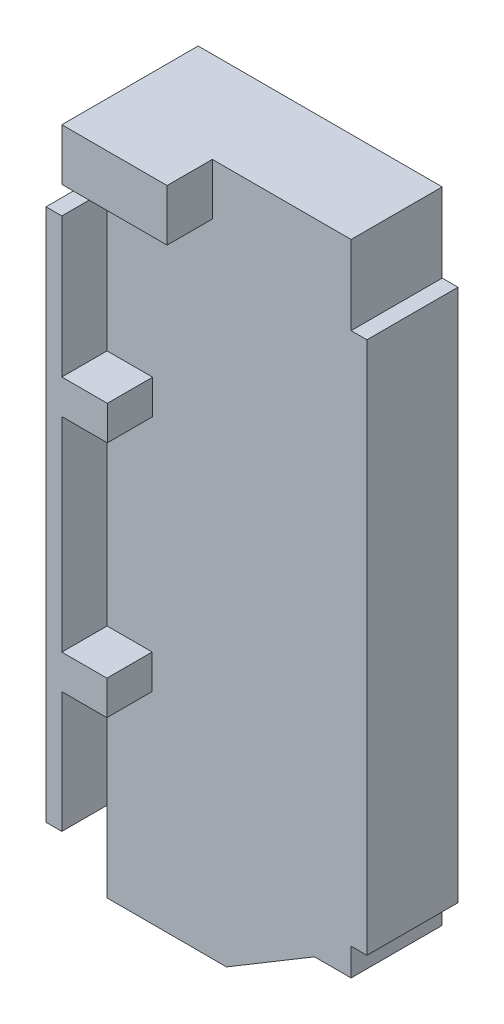
from build123d import *

# Parameters (mm, degrees)
BOSS_EXTRUDE1_DEPTH = 43.942
SKETCH2_6_W         = 50.8
SKETCH2_6_H         = 24.9047
BOSS_EXTRUDE3_DEPTH = 21.844


with BuildPart() as part:
    # Sketch2 → Boss-Extrude1 (new body)
    with BuildSketch(Plane.XY):
        Polygon((-25.4, 384.175), (-33.02, 384.175), (-33.02, 127), (-25.4, 127), (-25.4, 88.2904), (32.21228, 88.2904), (74.6506, 113.7158), (92.329, 113.7158), (92.329, 127), (99.949, 127), (99.949, 384.175), (92.329, 384.175), (92.329, 422.275), (-25.4, 422.275), align=None)
    extrude(amount=-BOSS_EXTRUDE1_DEPTH)

    # Sketch2<6> → Boss-Extrude3 (add)
    with BuildSketch(Plane.XY):
        Polygon((-25.4, 316.865), (-25.4, 384.175), (-33.02, 384.175), (-33.02, 127), (-25.4, 127), (-25.4, 185.42), (-3.6576, 185.42), (-3.6576, 201.93), (-25.4, 201.93), (-25.4, 300.355), (-3.429, 300.355), (-3.429, 316.865), align=None)
        with Locations((0, 409.82265)):
            Rectangle(SKETCH2_6_W, SKETCH2_6_H)
    extrude(amount=BOSS_EXTRUDE3_DEPTH)


solid = part.part
